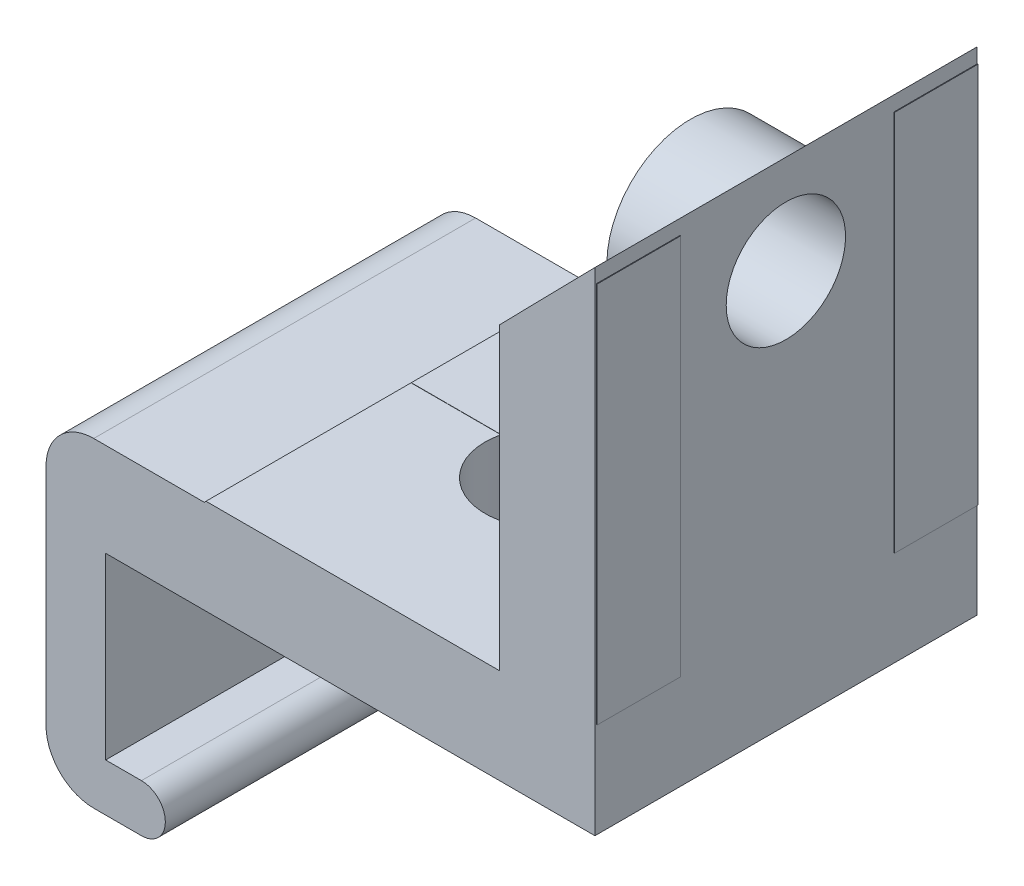
from build123d import *

# Parameters (mm, degrees)
SKETCH1_W                      = 30.121125575
SKETCH1_H                      = 11.523232915
BOSS_EXTRUDE1_DEPTH            = 4
SKETCH2_W                      = 0.023452759
SKETCH2_H                      = 13.5
CUT_EXTRUDE1_DEPTH             = 4
SKETCH3_W                      = 11.499780156
SKETCH3_H                      = 13.5
BOSS_EXTRUDE2_DEPTH            = 19
CUT_EXTRUDE2_DEPTH             = 47.721095233
DRAFT1_ANGLE                   = -45.58058215
SKETCH5_W                      = 11.499780156
SKETCH5_H                      = 0.083772182
CUT_EXTRUDE3_DEPTH             = 6.630261323
SKETCH6_W                      = 20.5
SKETCH6_H                      = 11.499780156
CUT_EXTRUDE4_DEPTH             = 7.5
BOSS_EXTRUDE3_START            = 4.500219844
BOSS_EXTRUDE3_DEPTH            = 4.500219844
SKETCH8_W                      = 8.592269897
SKETCH8_H                      = 0.01006031
CUT_EXTRUDE5_DEPTH             = 12.369738677
DRAFT2_ANGLE                   = 44.41941785
FILLET1_R                      = 2
CUT_EXTRUDE6_REACH             = 50.022
SKETCH10_W                     = 3.5
SKETCH10_H                     = 16
BOSS_EXTRUDE4_DEPTH            = 0.02681
SKETCH11_W                     = 3.5
SKETCH11_H                     = 16
BOSS_EXTRUDE5_DEPTH            = 0.02681
BOSS_EXTRUDE6_DEPTH            = 3.5
F_5_2_5_2_DIAMETER_HOLE1_D     = 5.2
F_5_2_5_2_DIAMETER_HOLE1_DEPTH = 20.621150575
F_5_0_5_DIAMETER_HOLE1_D       = 5
F_5_0_5_DIAMETER_HOLE1_DEPTH   = 4.026810169
BOSS_EXTRUDE7_START            = -4
SKETCH17_R                     = 3.5
SKETCH17_R_2                   = 2.5
BOSS_EXTRUDE7_DEPTH            = 4


with BuildPart() as part:
    # Sketch1 → Boss-Extrude1 (new body)
    with BuildSketch(Plane(origin=(16, 0, 0), x_dir=(0, -1, 0), z_dir=(-1, 0, 0))):
        with Locations((-25.560562788, 220.238163699)):
            Rectangle(SKETCH1_W, SKETCH1_H)
    extrude(amount=-BOSS_EXTRUDE1_DEPTH)

    # Sketch2 → Cut-Extrude1 (cut)
    with BuildSketch(Plane(origin=(20, 0, 0), x_dir=(0, 0, -1), z_dir=(1, 0, 0))):
        with Locations((-214.488273621, 17.25)):
            Rectangle(SKETCH2_W, SKETCH2_H)
    extrude(amount=-CUT_EXTRUDE1_DEPTH, mode=Mode.SUBTRACT)

    # Sketch3 → Boss-Extrude2 (add)
    with BuildSketch(Plane.ZY.offset(-16)):
        with Locations((220.249890078, 17.25)):
            Rectangle(SKETCH3_W, SKETCH3_H)
    extrude(amount=BOSS_EXTRUDE2_DEPTH)

    # Sketch4 → Cut-Extrude2 (cut, through all)
    with BuildSketch(Plane.XY.offset(225.999780156)):
        with BuildLine():
            Line((1, 10.5), (20, 10.5))
            Line((20, 10.5), (20, 12.5))
            Line((20, 12.5), (1, 12.5))
            ThreePointArc((1, 12.5), (2, 11.5), (1, 10.5))
        make_face()
    extrude(amount=-CUT_EXTRUDE2_DEPTH, mode=Mode.SUBTRACT)

    # Draft1
    draft1_faces = [part.faces().sort_by_distance(p)[0] for p in [
        (18, 40.621125575, 220.238163698),
    ]]
    draft(draft1_faces, Plane(origin=(20, 0, 0), x_dir=(0, 0, 1), z_dir=(1, 0, 0)), DRAFT1_ANGLE)

    # Sketch5 → Cut-Extrude3 (cut)
    with BuildSketch(Plane.ZY.offset(3)):
        with Locations((220.249890078, 23.958113909)):
            Rectangle(SKETCH5_W, SKETCH5_H)
    extrude(amount=-CUT_EXTRUDE3_DEPTH, mode=Mode.SUBTRACT)

    # Sketch6 → Cut-Extrude4 (cut)
    with BuildSketch(Plane.XZ.offset(-12.5)):
        with Locations((9.75, 220.249890078)):
            Rectangle(SKETCH6_W, SKETCH6_H)
    extrude(amount=-CUT_EXTRUDE4_DEPTH, mode=Mode.SUBTRACT)

    # Sketch7 → Boss-Extrude3 (add)
    with BuildSketch(Plane.XY.offset(225.999780156).offset(BOSS_EXTRUDE3_START)):
        with BuildLine():
            Line((-3, 10.5), (-3, 23.916227818))
            Line((-3, 23.916227818), (3.630261323, 23.916227818))
            Line((3.630261323, 23.916227818), (3.630261323, 24))
            Line((3.630261323, 24), (16, 24))
            Line((16, 24), (16, 36.539228341))
            Line((16, 36.539228341), (20, 40.621125575))
            Line((20, 40.621125575), (20, 20))
            Line((20, 20), (-0.5, 20))
            Line((-0.5, 20), (-0.5, 12.5))
            Line((-0.5, 12.5), (1, 12.5))
            ThreePointArc((1, 12.5), (2, 11.5), (1, 10.5))
            Line((1, 10.5), (-3, 10.5))
        make_face()
    extrude(amount=-BOSS_EXTRUDE3_DEPTH)

    # Sketch8 → Cut-Extrude5 (cut)
    with BuildSketch(Plane.ZY.offset(-3.630261323)):
        with Locations((226.203865052, 23.994969845)):
            Rectangle(SKETCH8_W, SKETCH8_H)
    extrude(amount=-CUT_EXTRUDE5_DEPTH, mode=Mode.SUBTRACT)

    # Draft2
    draft2_faces = [part.faces().sort_by_distance(p)[0] for p in [
        (3.630261323, 23.955573176, 222.244667153),
    ]]
    draft(draft2_faces, Plane(origin=(3.630261323, 23.916227818, 214.5), x_dir=(0, 0, 1), z_dir=(0, 1, 0)), DRAFT2_ANGLE)

    # Fillet1
    fillet1_edges = [part.edges().sort_by_distance(p)[0] for p in [
        (-3, 10.5, 222.5),
        (-3, 23.916227818, 222.5),
    ]]
    fillet(fillet1_edges, radius=FILLET1_R)

    # Sketch9 → Cut-Extrude6 (cut, up to next)
    with BuildSketch(Plane.XY.offset(214.5), mode=Mode.PRIVATE) as cut_extrude6_sk1:
        Polygon((20, 40), (20, 40.621125575), (19.391336391, 40), align=None)
    cut_extrude6_tool1 = extrude(cut_extrude6_sk1.sketch, amount=-CUT_EXTRUDE6_REACH, mode=Mode.PRIVATE) & part.part
    add(cut_extrude6_tool1.solids().sort_by_distance((19.797112, 40.207042, 214.5))[0], mode=Mode.SUBTRACT)

    # Sketch10 → Boss-Extrude4 (add)
    with BuildSketch(Plane(origin=(20.026810169, 0, 0), x_dir=(0, 0, -1), z_dir=(1, 0, 0))):
        with Locations((-216.226547241, 32)):
            Rectangle(SKETCH10_W, SKETCH10_H)
    extrude(amount=-BOSS_EXTRUDE4_DEPTH)

    # Sketch11 → Boss-Extrude5 (add)
    with BuildSketch(Plane(origin=(20.026810169, 0, 0), x_dir=(0, 0, -1), z_dir=(1, 0, 0))):
        with Locations((-228.683158875, 32)):
            Rectangle(SKETCH11_W, SKETCH11_H)
    extrude(amount=-BOSS_EXTRUDE5_DEPTH)

    # Sketch12 → Boss-Extrude6 (add)
    with BuildSketch(Plane(origin=(0, 0, 214.476547241), x_dir=(-1, 0, 0), z_dir=(0, 0, -1))):
        Polygon((-16, 24), (-3.71235274, 24), (-16, 36.539228341), align=None)
    extrude(amount=-BOSS_EXTRUDE6_DEPTH)

    # Ø5.2 (5.2) Diameter Hole1
    with Locations(Plane(origin=(0, 20, 0), x_dir=(-1, 0, 0), z_dir=(0, -1, 0))):
        with Locations((-10, -222.5)):
            Hole(F_5_2_5_2_DIAMETER_HOLE1_D / 2, depth=F_5_2_5_2_DIAMETER_HOLE1_DEPTH)

    # Ø5.0 (5) Diameter Hole1
    with Locations(Plane.ZY.offset(-16)):
        with Locations((222.5, 36.5)):
            Hole(F_5_0_5_DIAMETER_HOLE1_D / 2, depth=F_5_0_5_DIAMETER_HOLE1_DEPTH)

    # Sketch17 → Boss-Extrude7 (add)
    with BuildSketch(Plane.ZY.offset(-16).offset(BOSS_EXTRUDE7_START)):
        with Locations((222.5, 36.5)):
            Circle(SKETCH17_R)
        with Locations((222.5, 36.5)):
            Circle(SKETCH17_R_2, mode=Mode.SUBTRACT)
    extrude(amount=BOSS_EXTRUDE7_DEPTH)


solid = part.part
